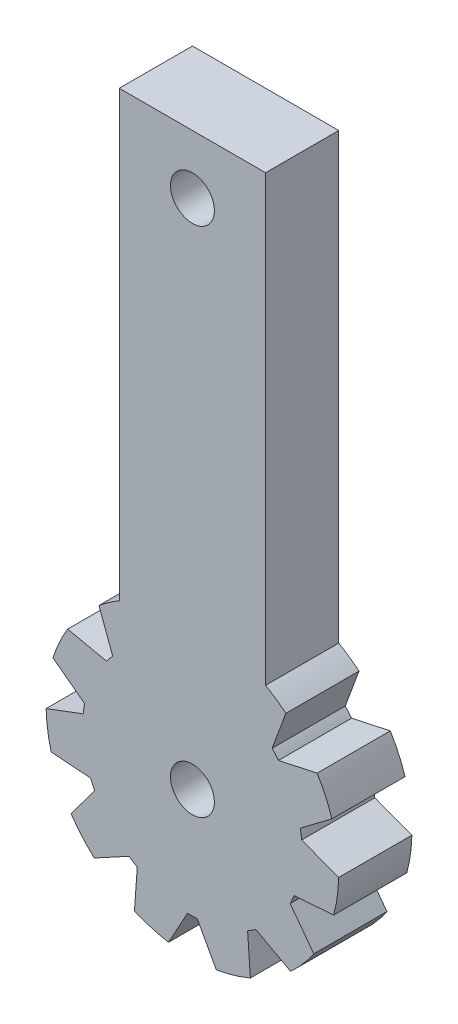
from build123d import *

# Parameters (mm, degrees)
BOSS_EXTRUDE1_DEPTH = 5
SKETCH5_R           = 2.425
CUT_EXTRUDE2_DEPTH  = 2.7
SKETCH6_R           = 1.5
CUT_EXTRUDE3_DEPTH  = 12
SKETCH7_W           = 10
SKETCH7_H           = 35
BOSS_EXTRUDE3_DEPTH = 5
SKETCH8_R           = 1.5
CUT_EXTRUDE4_DEPTH  = 12


with BuildPart() as part:
    # Sketch1 → Boss-Extrude1 (new body)
    with BuildSketch(Plane.XY):
        with BuildLine():
            Line((-1.212917817, 9.926168967), (-1.792316692, 7.28269187))
            ThreePointArc((-1.792316692, 7.28269187), (-2.112994176, 7.196197302), (-2.429527737, 7.095589826))
            Line((-2.429527737, 7.095589826), (-4.346120706, 9.006177592))
            ThreePointArc((-4.346120706, 9.006177592), (-5.406408175, 8.412535328), (-6.386863504, 7.694671831))
            Line((-6.386863504, 7.694671831), (-5.445113235, 5.157590703))
            ThreePointArc((-5.445113235, 5.157590703), (-5.668121808, 4.911455505), (-5.880014276, 4.655688147))
            Line((-5.880014276, 4.655688147), (-8.525296613, 5.226788465))
            ThreePointArc((-8.525296613, 5.226788465), (-9.096319954, 4.15415013), (-9.533025155, 3.020170756))
            Line((-9.533025155, 3.020170756), (-7.369124799, 1.394990929))
            ThreePointArc((-7.369124799, 1.394990929), (-7.423660814, 1.067361287), (-7.463637828, 0.737638377))
            Line((-7.463637828, 0.737638377), (-9.997751083, -0.212069068))
            ThreePointArc((-9.997751083, -0.212069068), (-9.898214419, -1.423148383), (-9.652518677, -2.613213194))
            Line((-9.652518677, -2.613213194), (-6.953491308, -2.810508608))
            ThreePointArc((-6.953491308, -2.810508608), (-6.822239965, -3.115612598), (-6.677609105, -3.414606366))
            Line((-6.677609105, -3.414606366), (-8.295990224, -5.583596171))
            ThreePointArc((-8.295990224, -5.583596171), (-7.557495744, -6.548607339), (-6.70740572, -7.416920419))
            Line((-6.70740572, -7.416920419), (-4.330173457, -6.12369152))
            ThreePointArc((-4.330173457, -6.12369152), (-4.054806131, -6.309401496), (-3.771486674, -6.482737714))
            Line((-3.771486674, -6.482737714), (-3.960311086, -9.182370941))
            ThreePointArc((-3.960311086, -9.182370941), (-2.817325568, -9.594929736), (-1.63273884, -9.865807817))
            Line((-1.63273884, -9.865807817), (-0.332056129, -7.492645643))
            ThreePointArc((-0.332056129, -7.492645643), (0, -7.5), (0.332056129, -7.492645643))
            Line((0.332056129, -7.492645643), (1.63273884, -9.865807817))
            ThreePointArc((1.63273884, -9.865807817), (2.817325568, -9.594929736), (3.960311086, -9.182370941))
            Line((3.960311086, -9.182370941), (3.771486674, -6.482737714))
            ThreePointArc((3.771486674, -6.482737714), (4.054806131, -6.309401496), (4.330173457, -6.12369152))
            Line((4.330173457, -6.12369152), (6.70740572, -7.416920419))
            ThreePointArc((6.70740572, -7.416920419), (7.557495744, -6.548607339), (8.295990224, -5.583596171))
            Line((8.295990224, -5.583596171), (6.677609105, -3.414606366))
            ThreePointArc((6.677609105, -3.414606366), (6.822239965, -3.115612598), (6.953491308, -2.810508608))
            Line((6.953491308, -2.810508608), (9.652518677, -2.613213194))
            ThreePointArc((9.652518677, -2.613213194), (9.898214419, -1.423148383), (9.997751083, -0.212069068))
            Line((9.997751083, -0.212069068), (7.463637828, 0.737638377))
            ThreePointArc((7.463637828, 0.737638377), (7.423660814, 1.067361287), (7.369124799, 1.394990929))
            Line((7.369124799, 1.394990929), (9.533025155, 3.020170756))
            ThreePointArc((9.533025155, 3.020170756), (9.096319954, 4.15415013), (8.525296613, 5.226788465))
            Line((8.525296613, 5.226788465), (5.880014276, 4.655688147))
            ThreePointArc((5.880014276, 4.655688147), (5.668121808, 4.911455505), (5.445113235, 5.157590703))
            Line((5.445113235, 5.157590703), (6.386863504, 7.694671831))
            ThreePointArc((6.386863504, 7.694671831), (5.406408175, 8.412535328), (4.346120706, 9.006177592))
            Line((4.346120706, 9.006177592), (2.429527737, 7.095589826))
            ThreePointArc((2.429527737, 7.095589826), (2.112994176, 7.196197302), (1.792316692, 7.28269187))
            Line((1.792316692, 7.28269187), (1.212917817, 9.926168967))
            ThreePointArc((1.212917817, 9.926168967), (0, 10), (-1.212917817, 9.926168967))
        make_face()
    extrude(amount=BOSS_EXTRUDE1_DEPTH)

    # Sketch5 → Cut-Extrude2 (cut)
    with BuildSketch(Plane(origin=(0, 0, 0), x_dir=(-1, 0, 0), z_dir=(0, 0, -1))):
        Circle(SKETCH5_R)
    extrude(amount=-CUT_EXTRUDE2_DEPTH, mode=Mode.SUBTRACT)

    # Sketch6 → Cut-Extrude3 (cut)
    with BuildSketch(Plane(origin=(0, 0, 2.7), x_dir=(-1, 0, 0), z_dir=(0, 0, -1))):
        Circle(SKETCH6_R)
    extrude(amount=-CUT_EXTRUDE3_DEPTH, mode=Mode.SUBTRACT)

    # Sketch7 → Boss-Extrude3 (add)
    with BuildSketch(Plane(origin=(0, 0, 0), x_dir=(-1, 0, 0), z_dir=(0, 0, -1))):
        with Locations((0, 21.5)):
            Rectangle(SKETCH7_W, SKETCH7_H)
    extrude(amount=-BOSS_EXTRUDE3_DEPTH)

    # Sketch8 → Cut-Extrude4 (cut)
    with BuildSketch(Plane(origin=(0, 0, 0), x_dir=(-1, 0, 0), z_dir=(0, 0, -1))):
        with Locations((0, 35)):
            Circle(SKETCH8_R)
    extrude(amount=-CUT_EXTRUDE4_DEPTH, mode=Mode.SUBTRACT)


solid = part.part
